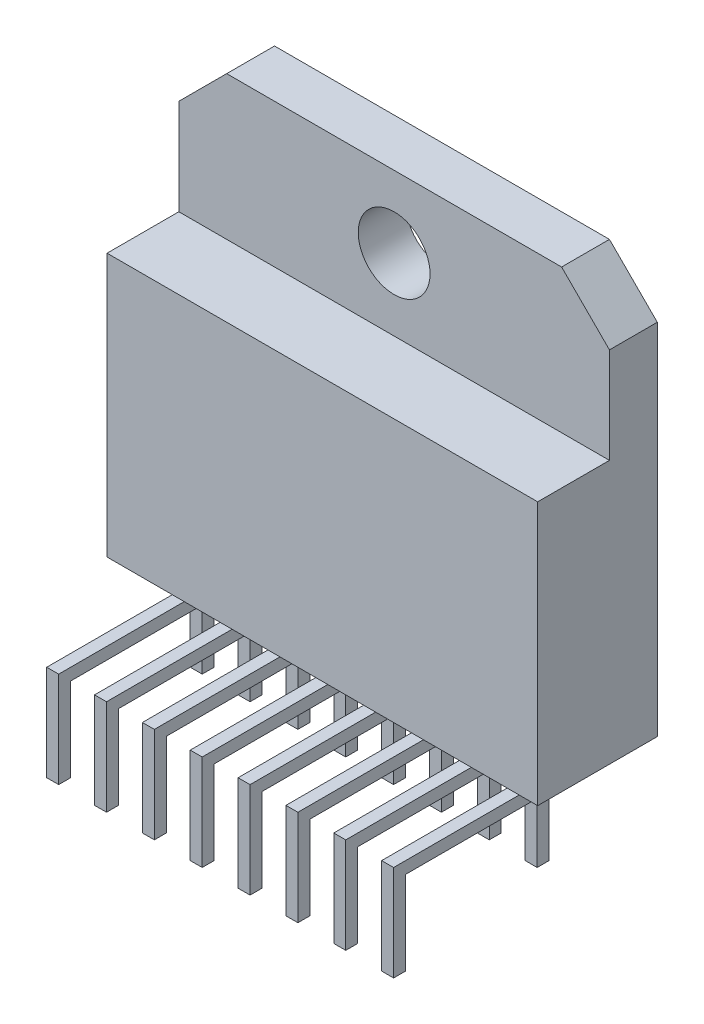
from build123d import *

# Parameters (mm, degrees)
BOSS_EXTRUDE1_DEPTH = 18
SKETCH3_R           = 1.5
CUT_EXTRUDE1_DEPTH  = 25.939927827
CHAMFER1_SIZE       = 2
BOSS_EXTRUDE2_DEPTH = 0.5
LPATTERN1_COUNT     = 8
LPATTERN1_PITCH     = 2
SKETCH5_W           = 0.5
SKETCH5_H           = 4.5
BOSS_EXTRUDE3_DEPTH = 0.5
LPATTERN2_COUNT     = 8
LPATTERN2_PITCH     = 2


with BuildPart() as part:
    # Sketch2 → Boss-Extrude1 (new body)
    with BuildSketch(Plane(origin=(0, 0, 0), x_dir=(0, 0, -1), z_dir=(1, 0, 0))):
        Polygon((0, 0), (0, 17), (-2, 17), (-2, 11), (-5, 11), (-5, 0), align=None)
    extrude(amount=BOSS_EXTRUDE1_DEPTH)

    # Sketch3 → Cut-Extrude1 (cut, through all)
    with BuildSketch(Plane.XY.offset(2)):
        with Locations((9, 14)):
            Circle(SKETCH3_R)
    extrude(amount=-CUT_EXTRUDE1_DEPTH, mode=Mode.SUBTRACT)

    # Chamfer1
    chamfer1_edges = [part.edges().sort_by_distance(p)[0] for p in [
        (18, 17, 1),
        (0, 17, 1),
    ]]
    chamfer(chamfer1_edges, length=CHAMFER1_SIZE)

    # Sketch4 → Boss-Extrude2 (add)
    with BuildSketch(Plane(origin=(2.227, 0, 0), x_dir=(0, 0, -1), z_dir=(1, 0, 0))):
        Polygon((-2.25, 0), (-2.25, -1), (-9.25, -1), (-9.25, -4.5), (-9.75, -4.5), (-9.75, -0.5), (-2.75, -0.5), (-2.75, 0), align=None)
    boss_extrude2 = extrude(amount=BOSS_EXTRUDE2_DEPTH)

    # LPattern1: Boss-Extrude2 ×8
    with Locations(*[(i * LPATTERN1_PITCH, 0, 0) for i in range(1, LPATTERN1_COUNT)]):
        add(boss_extrude2)

    # Sketch5 → Boss-Extrude3 (add)
    with BuildSketch(Plane(origin=(1.227, 0, 0), x_dir=(0, 0, -1), z_dir=(1, 0, 0))):
        with Locations((-2.5, -2.25)):
            Rectangle(SKETCH5_W, SKETCH5_H)
    boss_extrude3 = extrude(amount=BOSS_EXTRUDE3_DEPTH)

    # LPattern2: Boss-Extrude3 ×8
    with Locations(*[(i * LPATTERN2_PITCH, 0, 0) for i in range(1, LPATTERN2_COUNT)]):
        add(boss_extrude3)


solid = part.part
